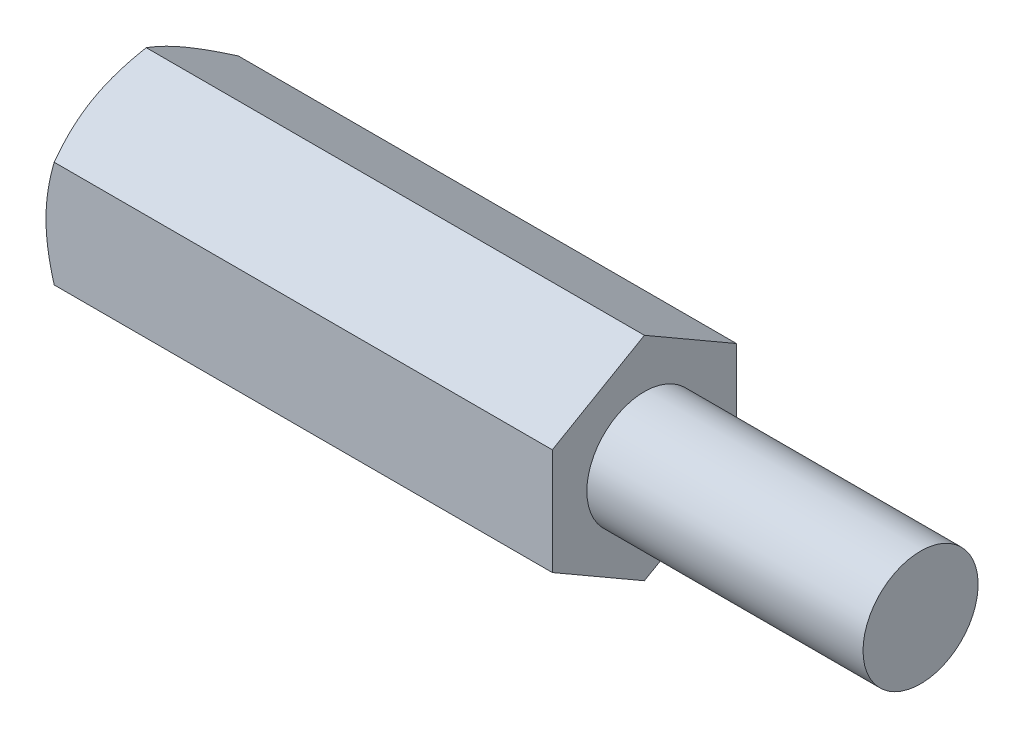
from build123d import *

# Parameters (mm, degrees)
SKETCH2_R          = 2.33256351
HEX_DIE_DEPTH      = 11
SKETCH5_R          = 1.003913097
CUT_EXTRUDE1_DEPTH = 6


with BuildPart() as part:
    # BodySke → Base-Revolve (revolve)
    with BuildSketch(Plane.XY, mode=Mode.PRIVATE) as base_revolve_sk:
        Polygon((11, 1.25), (11, 2.309468822), (0.178671908, 2.309468822), (0, 2), (0, 0), (17, 0), (17, 1.25), align=None)
    revolve(base_revolve_sk.sketch.rotate(Axis((-25.4, 0, 0), (1, 0, 0)), 90), axis=Axis((-25.4, 0, 0), (1, 0, 0)))

    # Sketch2 → Hex-Die (cut)
    with BuildSketch(Plane(origin=(0, 0, 0), x_dir=(0, 0, -1), z_dir=(1, 0, 0))):
        Circle(SKETCH2_R)
        Polygon((-2, 1.154700543), (0, 2.309401087), (2, 1.154700543), (2, -1.154700543), (0, -2.309401087), (-2, -1.154700543), align=None, mode=Mode.SUBTRACT)
    extrude(amount=HEX_DIE_DEPTH, mode=Mode.SUBTRACT)

    # Sketch5 → Cut-Extrude1 (cut)
    with BuildSketch(Plane.ZY):
        Circle(SKETCH5_R)
    extrude(amount=-CUT_EXTRUDE1_DEPTH, mode=Mode.SUBTRACT)


solid = part.part
